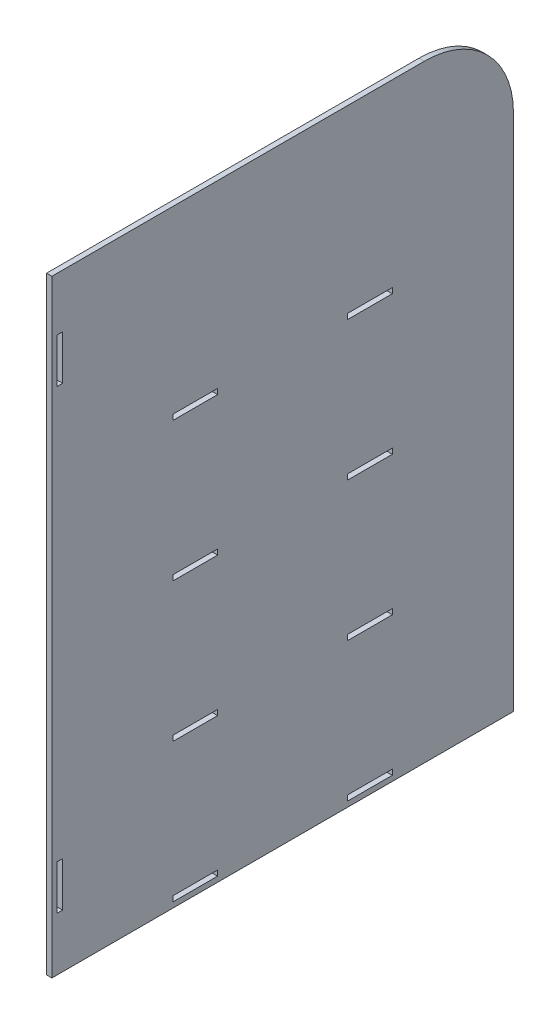
from build123d import *

# Parameters (mm, degrees)
SKETCH1_W           = 6
SKETCH1_H           = 50
SKETCH1_W_2         = 50
SKETCH1_H_2         = 6
BOSS_EXTRUDE1_DEPTH = 6


with BuildPart() as part:
    # Sketch1 → Boss-Extrude1 (new body)
    with BuildSketch(Plane(origin=(0, 0, 0), x_dir=(0, 0, -1), z_dir=(1, 0, 0))):
        with BuildLine():
            Line((-414.831767264, 357.151199882), (3.168232736, 357.151199882))
            ThreePointArc((3.168232736, 357.151199882), (73.878910855, 327.861878001), (103.168232736, 257.151199882))
            Line((103.168232736, 257.151199882), (103.168232736, -324.848800118))
            Line((103.168232736, -324.848800118), (-414.831767264, -324.848800118))
            Line((-414.831767264, -324.848800118), (-414.831767264, 357.151199882))
        make_face()
        with Locations((-405.831767264, 272.151199882)):
            Rectangle(SKETCH1_W, SKETCH1_H, mode=Mode.SUBTRACT)
        with Locations((-253.831767264, -315.848800118)):
            Rectangle(SKETCH1_W_2, SKETCH1_H_2, mode=Mode.SUBTRACT)
        with Locations((-57.831767264, -315.848800118)):
            Rectangle(SKETCH1_W_2, SKETCH1_H_2, mode=Mode.SUBTRACT)
        with Locations((-253.831767264, -159.848800118)):
            Rectangle(SKETCH1_W_2, SKETCH1_H_2, mode=Mode.SUBTRACT)
        with Locations((-57.831767264, -159.848800118)):
            Rectangle(SKETCH1_W_2, SKETCH1_H_2, mode=Mode.SUBTRACT)
        with Locations((-253.831767264, -3.848800118)):
            Rectangle(SKETCH1_W_2, SKETCH1_H_2, mode=Mode.SUBTRACT)
        with Locations((-57.831767264, -3.848800118)):
            Rectangle(SKETCH1_W_2, SKETCH1_H_2, mode=Mode.SUBTRACT)
        with Locations((-253.831767264, 152.151199882)):
            Rectangle(SKETCH1_W_2, SKETCH1_H_2, mode=Mode.SUBTRACT)
        with Locations((-57.831767264, 152.151199882)):
            Rectangle(SKETCH1_W_2, SKETCH1_H_2, mode=Mode.SUBTRACT)
        with Locations((-405.831767264, -239.848800118)):
            Rectangle(SKETCH1_W, SKETCH1_H, mode=Mode.SUBTRACT)
    extrude(amount=BOSS_EXTRUDE1_DEPTH)


solid = part.part
